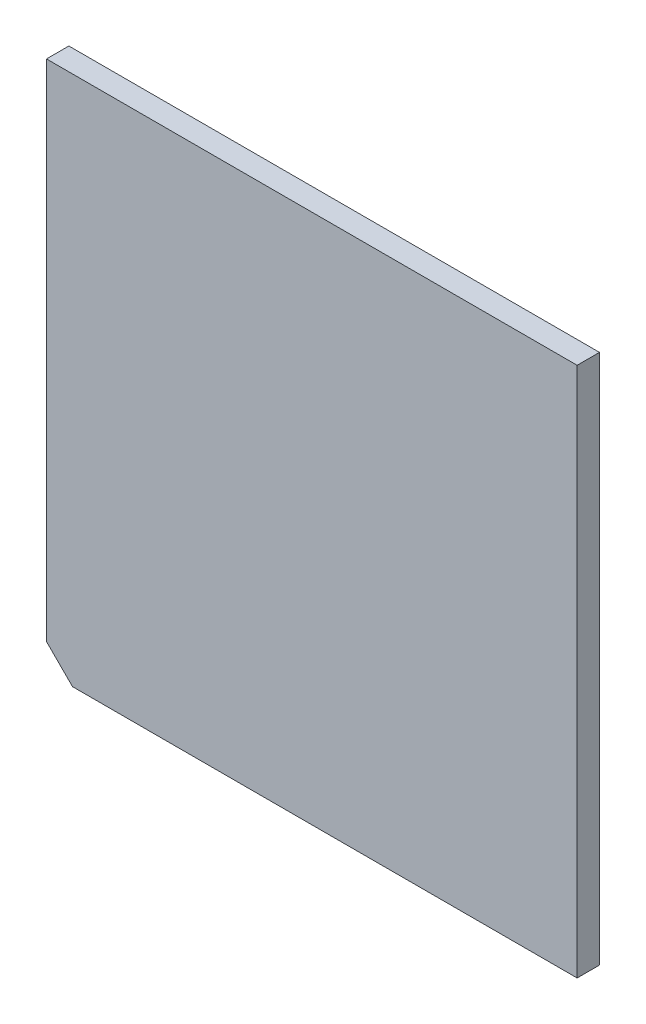
from build123d import *

# Parameters (mm, degrees)
SKETCH_1_W      = 102
SKETCH_1_H      = 102
EXTRUDE_1_DEPTH = 4.3
CHAMFER_1_SIZE  = 5


with BuildPart() as part:
    # 草图1 → 凸台-拉伸1 (new body)
    with BuildSketch(Plane.XY):
        Rectangle(SKETCH_1_W, SKETCH_1_H)
    extrude(amount=EXTRUDE_1_DEPTH)

    # 倒角1
    chamfer_1_edges = [part.edges().sort_by_distance(p)[0] for p in [
        (-51, -51, 2.15),
    ]]
    chamfer(chamfer_1_edges, length=CHAMFER_1_SIZE)


solid = part.part
